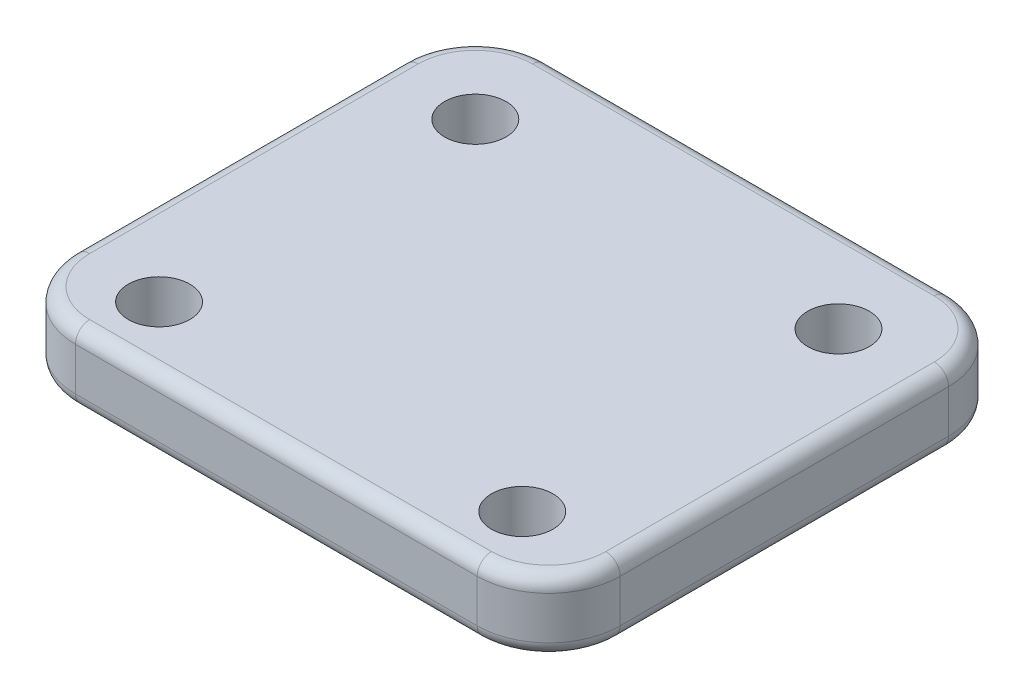
from build123d import *

# Parameters (mm, degrees)
SKETCH1_W           = 38.1
SKETCH1_H           = 32.97
SKETCH1_R           = 2.15
BOSS_EXTRUDE1_DEPTH = 5
FILLET1_R           = 5
FILLET2_R           = 1


with BuildPart() as part:
    # Sketch1 → Boss-Extrude1 (new body)
    with BuildSketch(Plane(origin=(0, 0, 0), x_dir=(1, 0, 0), z_dir=(0, 1, 0))):
        with Locations((19.05, -16.485)):
            Rectangle(SKETCH1_W, SKETCH1_H)
        with Locations(Location((6.35, -6.35, 0), (0, 0, 270))):
            Circle(SKETCH1_R, mode=Mode.SUBTRACT)
        with Locations(Location((31.75, -6.35, 0), (0, 0, 270))):
            Circle(SKETCH1_R, mode=Mode.SUBTRACT)
        with Locations(Location((31.75, -28.47, 0), (0, 0, 270))):
            Circle(SKETCH1_R, mode=Mode.SUBTRACT)
        with Locations(Location((6.35, -28.47, 0), (0, 0, 270))):
            Circle(SKETCH1_R, mode=Mode.SUBTRACT)
    extrude(amount=BOSS_EXTRUDE1_DEPTH)

    # Fillet1
    fillet1_edges = [part.edges().sort_by_distance(p)[0] for p in [
        (0, 2.5, 0),
        (38.1, 2.5, 0),
        (38.1, 2.5, 32.97),
        (0, 2.5, 32.97),
    ]]
    fillet(fillet1_edges, radius=FILLET1_R)

    # Fillet2
    fillet2_edges = [part.edges().sort_by_distance(p)[0] for p in [
        (0, 0, 16.485),
        (0, 5, 16.485),
        (19.05, 0, 0),
        (38.1, 0, 16.485),
        (19.05, 0, 32.97),
        (1.464466094, 0, 31.505533906),
        (36.635533906, 0, 31.505533906),
        (36.635533906, 0, 1.464466094),
        (1.464466094, 0, 1.464466094),
        (19.05, 5, 0),
        (19.05, 5, 32.97),
        (38.1, 5, 16.485),
        (1.464466094, 5, 31.505533906),
        (36.635533906, 5, 31.505533906),
        (36.635533906, 5, 1.464466094),
        (1.464466094, 5, 1.464466094),
    ]]
    fillet(fillet2_edges, radius=FILLET2_R)


solid = part.part
